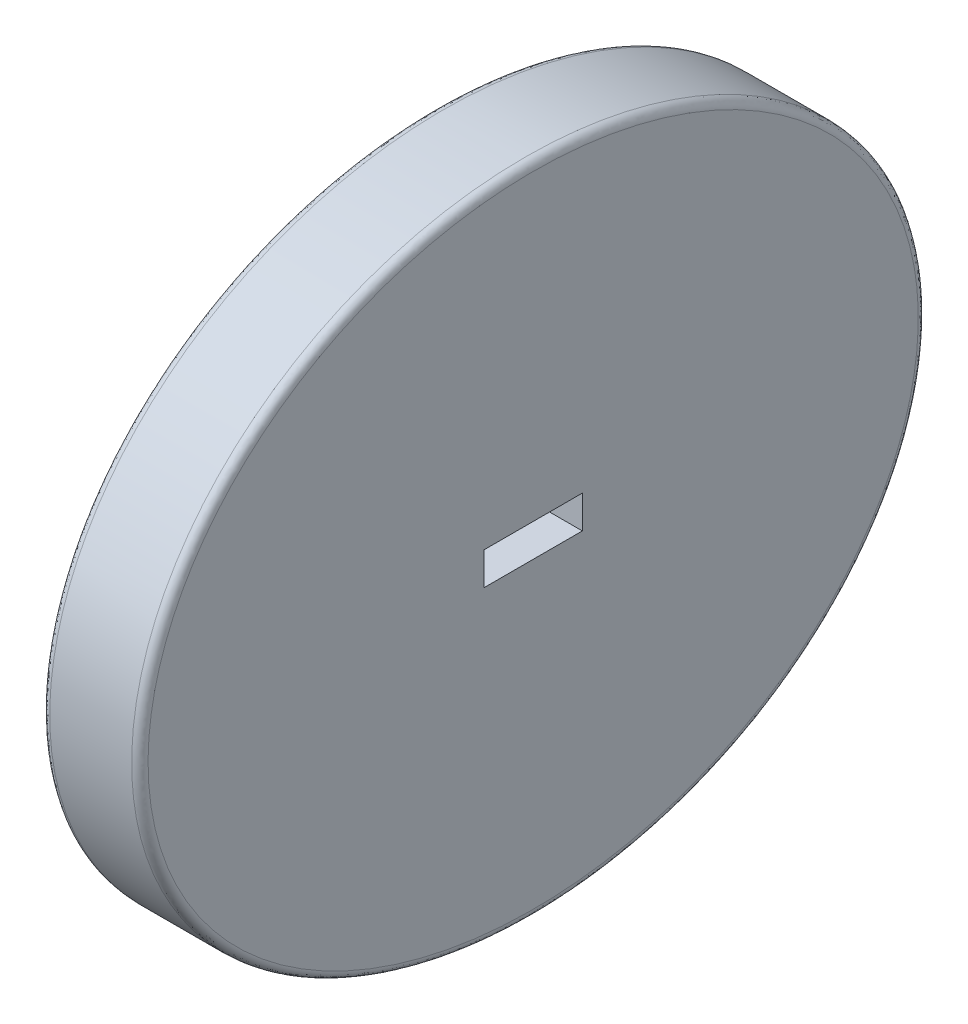
from build123d import *

# Parameters (mm, degrees)
SKETCH1_RX          = 76.2
SKETCH1_RY          = 63.5
SKETCH1_W           = 19.05
SKETCH1_H           = 6.35
BOSS_EXTRUDE1_DEPTH = 19.05
FILLET1_R           = 1.5875


with BuildPart() as part:
    # Sketch1 → Boss-Extrude1 (new body)
    with BuildSketch(Plane(origin=(0, 0, 0), x_dir=(0, 0, -1), z_dir=(1, 0, 0))):
        with Locations((0, 0)):
            Ellipse(SKETCH1_RX, SKETCH1_RY)
        Rectangle(SKETCH1_W, SKETCH1_H, mode=Mode.SUBTRACT)
    extrude(amount=BOSS_EXTRUDE1_DEPTH)

    # Fillet1
    fillet1_edges = [part.edges().sort_by_distance(p)[0] for p in [
        (0, -0.005294399, 76.199999735),
        (19.05, -0.005294399, 76.199999735),
    ]]
    fillet(fillet1_edges, radius=FILLET1_R)


solid = part.part
